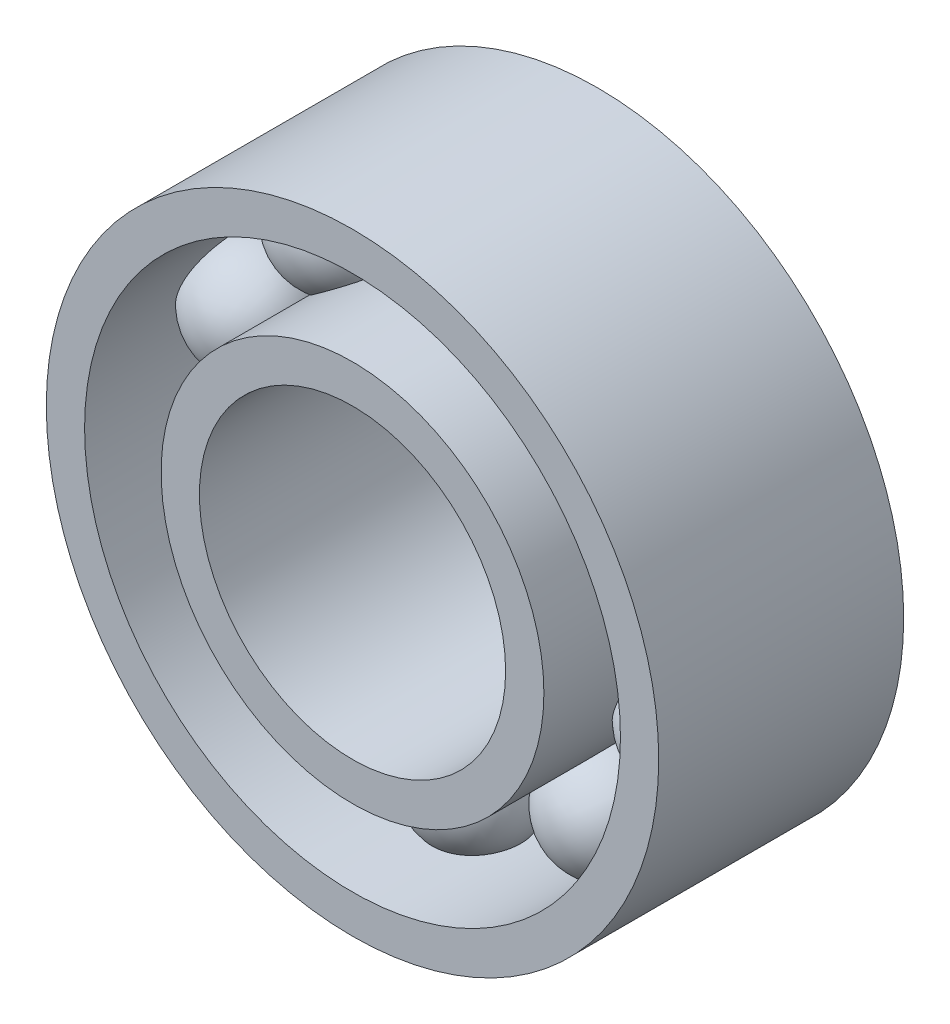
from build123d import *

# Parameters (mm, degrees)
SKETCH1_R           = 5
SKETCH1_R_2         = 2.5
BOSS_EXTRUDE1_DEPTH = 4
CUT_EXTRUDE1_REACH  = 10.124
SKETCH2_R           = 4.375
SKETCH2_R_2         = 3.125
CIRPATTERN1_COUNT   = 10


with BuildPart() as part:
    # Sketch1 → Boss-Extrude1 (new body)
    with BuildSketch(Plane.XY):
        Circle(SKETCH1_R)
        Circle(SKETCH1_R_2, mode=Mode.SUBTRACT)
    extrude(amount=BOSS_EXTRUDE1_DEPTH)

    # Sketch2 → Cut-Extrude1 (cut, up to next)
    with BuildSketch(Plane.XY, mode=Mode.PRIVATE) as cut_extrude1_sk1:
        Circle(SKETCH2_R)
        Circle(SKETCH2_R_2, mode=Mode.SUBTRACT)
    cut_extrude1_tool1 = extrude(cut_extrude1_sk1.sketch, amount=CUT_EXTRUDE1_REACH, mode=Mode.PRIVATE) & part.part
    add(cut_extrude1_tool1.solids().sort_by_distance((-4.251256, 0, 0))[0], mode=Mode.SUBTRACT)


with BuildPart() as cut_extrude1_piece_1:
    # of the separate pieces the step leaves, piece 1, a body of its own (cut_extrude1_pieces)
    add(part.part.solids().sort_by_distance((5, 0, 0))[0])



with BuildPart() as cut_extrude1_piece_2:
    # of the separate pieces the step leaves, piece 2, a body of its own (cut_extrude1_pieces)
    add(part.part.solids().sort_by_distance((3.125, 0, 0))[0])


with BuildPart() as cut_extrude1_piece_1_1:
    add(cut_extrude1_piece_1.part)

    add(cut_extrude1_piece_2.part)  # Revolve1 merges Cut-Extrude1 piece 2
    # Sketch3 → Revolve1 (revolve)
    with BuildSketch(Plane(origin=(0, 0, 0), x_dir=(0, 0, -1), z_dir=(1, 0, 0))):
        with BuildLine():
            Line((-2, 4.6875), (-2, 2.8125))
            ThreePointArc((-2, 2.8125), (-1.0625, 3.75), (-2, 4.6875))
        make_face()
    revolve1 = revolve(axis=Axis((0, 4.6875, 2), (0, -1, 0)))

    # CirPattern1: Revolve1 ×10 about axis
    cirpattern1_axis = Axis((0, 0, -0.2), (0, 0, 1))
    for i in range(1, CIRPATTERN1_COUNT):
        add(revolve1.rotate(cirpattern1_axis, i * 360 / CIRPATTERN1_COUNT))


solid = cut_extrude1_piece_1_1.part
